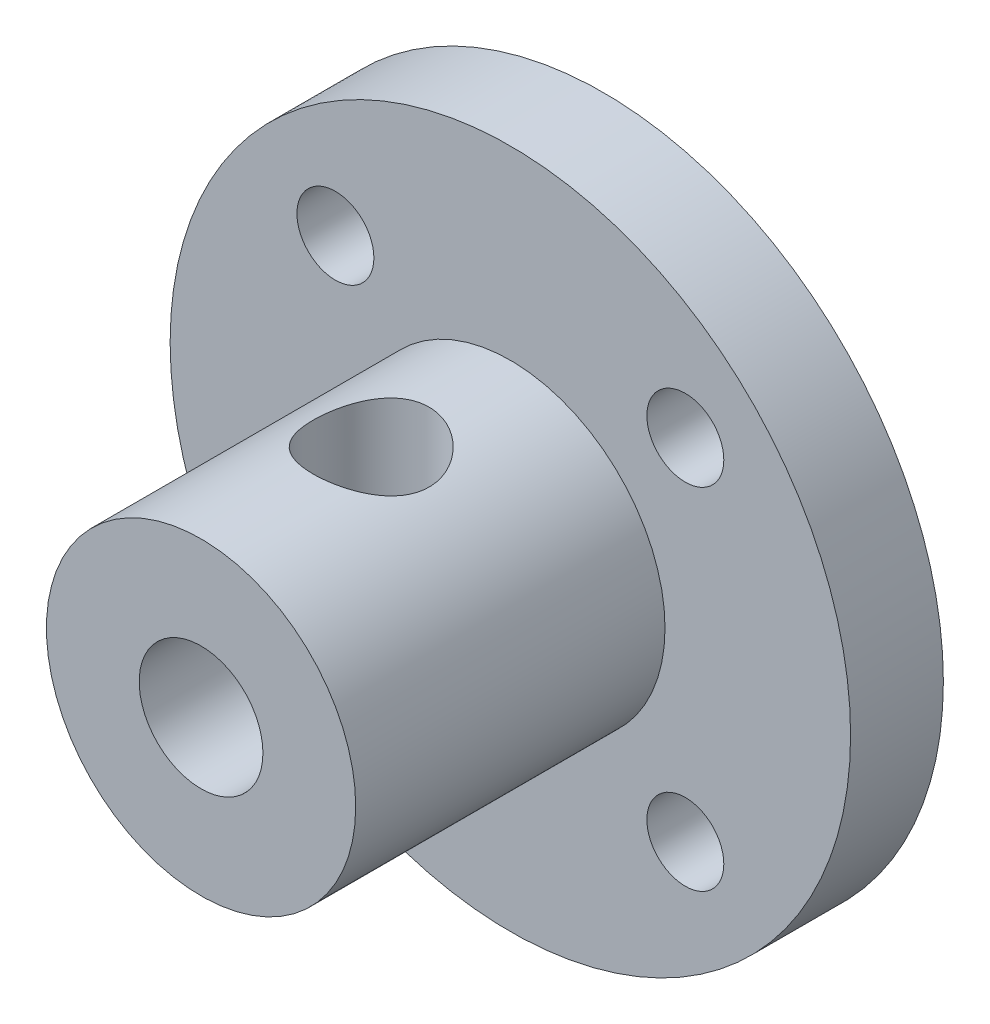
from build123d import *

# Parameters (mm, degrees)
SKETCH2_R           = 11
SKETCH2_R_2         = 2
SKETCH2_R_3         = 1.244152151
BOSS_EXTRUDE1_DEPTH = 3
SKETCH3_R           = 5
SKETCH3_R_2         = 2
BOSS_EXTRUDE3_DEPTH = 10
CUT_EXTRUDE2_START  = 5
SKETCH6_R           = 1.875
CUT_EXTRUDE2_DEPTH  = 3.2
SKETCH10_R          = 1.5
CUT_EXTRUDE3_DEPTH  = 3


with BuildPart() as part:
    # Sketch2 → Boss-Extrude1 (new body)
    with BuildSketch(Plane.XY):
        Circle(SKETCH2_R)
        Circle(SKETCH2_R_2, mode=Mode.SUBTRACT)
        with Locations((-5.656854249, 5.656854249)):
            Circle(SKETCH2_R_3, mode=Mode.SUBTRACT)
        with Locations((5.656854249, 5.656854249)):
            Circle(SKETCH2_R_3, mode=Mode.SUBTRACT)
        with Locations((5.656854249, -5.656854249)):
            Circle(SKETCH2_R_3, mode=Mode.SUBTRACT)
        with Locations((-5.656854249, -5.656854249)):
            Circle(SKETCH2_R_3, mode=Mode.SUBTRACT)
    extrude(amount=BOSS_EXTRUDE1_DEPTH)

    # Sketch3 → Boss-Extrude3 (add)
    with BuildSketch(Plane.XY.offset(3)):
        Circle(SKETCH3_R)
        Circle(SKETCH3_R_2, mode=Mode.SUBTRACT)
    extrude(amount=BOSS_EXTRUDE3_DEPTH)

    # Sketch6 → Cut-Extrude2 (cut)
    with BuildSketch(Plane(origin=(0, 0, 0), x_dir=(1, 0, 0), z_dir=(0, 1, 0)).offset(CUT_EXTRUDE2_START)):
        with Locations(Location((0, -7.5, 0), (0, 0, 270))):
            Circle(SKETCH6_R)
    extrude(amount=-CUT_EXTRUDE2_DEPTH, mode=Mode.SUBTRACT)

    # Sketch10 → Cut-Extrude3 (cut)
    with BuildSketch(Plane(origin=(0, 0, 0), x_dir=(1, 0, 0), z_dir=(0, 1, 0))):
        with Locations((0, -7.5)):
            Circle(SKETCH10_R)
    extrude(amount=CUT_EXTRUDE3_DEPTH, mode=Mode.SUBTRACT)


solid = part.part
